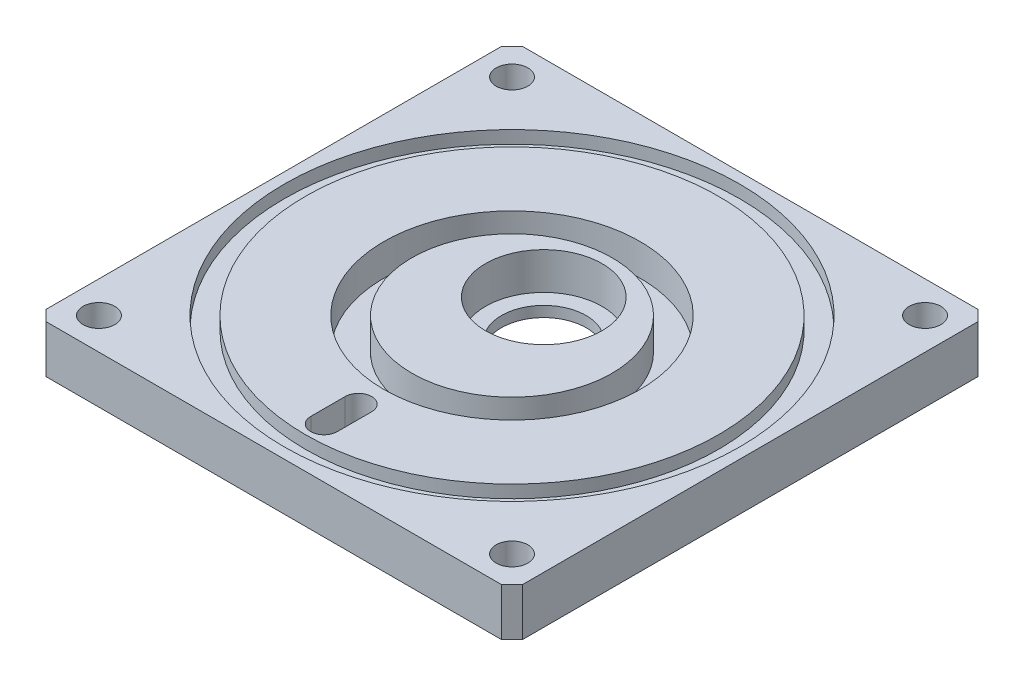
from build123d import *

# Parameters (mm, degrees)
SKETCH_1_W          = 45
SKETCH_1_H          = 45
EXTRUDE_1_DEPTH     = 4.5
SKETCH_2_R          = 5.5
CUT_EXTRUDE_1_DEPTH = 3.5
SKETCH_3_R          = 4
CUT_EXTRUDE_2_DEPTH = 33.011716605
SKETCH_4_R          = 12.1
SKETCH_4_R_2        = 9.45
CUT_EXTRUDE_3_DEPTH = 3
SKETCH_5_R          = 21.5
SKETCH_5_R_2        = 19.5
CUT_EXTRUDE_4_DEPTH = 1.2
CUT_EXTRUDE_5_DEPTH = 33.136427928
SKETCH_8_R          = 1.5
CUT_EXTRUDE_6_DEPTH = 33.136427928
CHAMFER_1_SIZE      = 1


with BuildPart() as part:
    # 草图1 → 凸台-拉伸1 (new body)
    with BuildSketch(Plane(origin=(0, 0, 0), x_dir=(1, 0, 0), z_dir=(0, 1, 0))):
        Rectangle(SKETCH_1_W, SKETCH_1_H)
    extrude(amount=EXTRUDE_1_DEPTH)

    # 草图2 → 切除-拉伸1 (cut)
    with BuildSketch(Plane(origin=(0, 4.5, 0), x_dir=(1, 0, 0), z_dir=(0, 1, 0))):
        with Locations(Location((0, 3, 0), (0, 0, 270))):
            Circle(SKETCH_2_R)
    extrude(amount=-CUT_EXTRUDE_1_DEPTH, mode=Mode.SUBTRACT)

    # 草图3 → 切除-拉伸2 (cut, through all)
    with BuildSketch(Plane(origin=(0, 1, 0), x_dir=(1, 0, 0), z_dir=(0, 1, 0))):
        with Locations(Location((0, 3, 0), (0, 0, 270))):
            Circle(SKETCH_3_R)
    extrude(amount=-CUT_EXTRUDE_2_DEPTH, mode=Mode.SUBTRACT)

    # 草图4 → 切除-拉伸3 (cut)
    with BuildSketch(Plane(origin=(0, 4.5, 0), x_dir=(1, 0, 0), z_dir=(0, 1, 0))):
        with Locations(Location((0, 0, 0), (0, 0, 270))):
            Circle(SKETCH_4_R)
        with Locations(Location((0, 0, 0), (0, 0, 270))):
            Circle(SKETCH_4_R_2, mode=Mode.SUBTRACT)
    extrude(amount=-CUT_EXTRUDE_3_DEPTH, mode=Mode.SUBTRACT)

    # 草图5 → 切除-拉伸4 (cut)
    with BuildSketch(Plane(origin=(0, 4.5, 0), x_dir=(1, 0, 0), z_dir=(0, 1, 0))):
        with Locations(Location((0, 0, 0), (0, 0, 270))):
            Circle(SKETCH_5_R)
        with Locations(Location((0, 0, 0), (0, 0, 270))):
            Circle(SKETCH_5_R_2, mode=Mode.SUBTRACT)
    extrude(amount=-CUT_EXTRUDE_4_DEPTH, mode=Mode.SUBTRACT)

    # 草图6 → 切除-拉伸5 (cut, through all)
    with BuildSketch(Plane(origin=(0, 4.5, 0), x_dir=(1, 0, 0), z_dir=(0, 1, 0))):
        with BuildLine():
            Line((1.25, -14.5), (1.25, -17.75))
            ThreePointArc((1.25, -17.75), (0, -19), (-1.25, -17.75))
            Line((-1.25, -17.75), (-1.25, -14.5))
            ThreePointArc((-1.25, -14.5), (0, -13.25), (1.25, -14.5))
        make_face()
    extrude(amount=-CUT_EXTRUDE_5_DEPTH, mode=Mode.SUBTRACT)

    # 草图8 → 切除-拉伸6 (cut, through all)
    with BuildSketch(Plane.XZ):
        with Locations(Location((-19.5, 19.5, 0), (0, 0, 270))):
            Circle(SKETCH_8_R)
        with Locations(Location((19.5, 19.5, 0), (0, 0, 90))):
            Circle(SKETCH_8_R)
        with Locations(Location((19.5, -19.5, 0), (0, 0, 270))):
            Circle(SKETCH_8_R)
        with Locations(Location((-19.5, -19.5, 0), (0, 0, 90))):
            Circle(SKETCH_8_R)
    extrude(amount=-CUT_EXTRUDE_6_DEPTH, mode=Mode.SUBTRACT)

    # 倒角1
    chamfer_1_edges = [part.edges().sort_by_distance(p)[0] for p in [
        (22.5, 2.25, 22.5),
        (-22.5, 2.25, 22.5),
        (-22.5, 2.25, -22.5),
        (22.5, 2.25, -22.5),
    ]]
    chamfer(chamfer_1_edges, length=CHAMFER_1_SIZE)


solid = part.part
